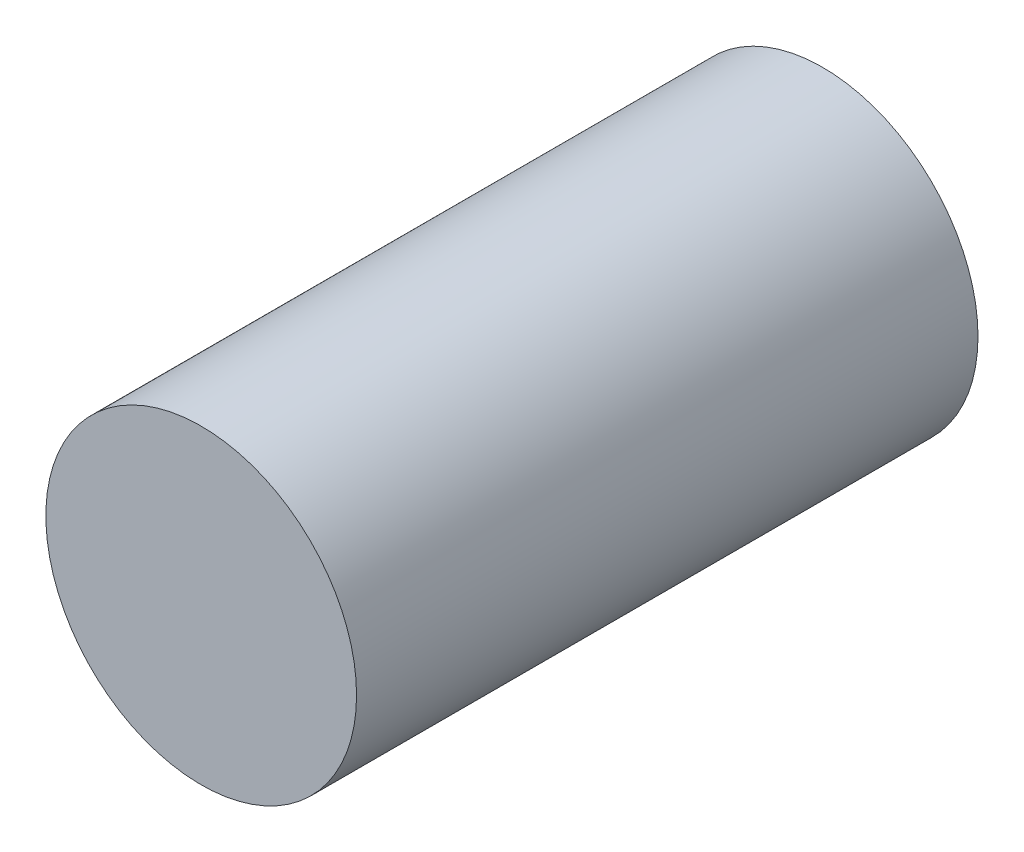
from build123d import *

# Parameters (mm, degrees)
SKETCH2_R           = 2.5
BOSS_EXTRUDE1_DEPTH = 10
CUT_EXTRUDE1_DEPTH  = 9


with BuildPart() as part:
    # Sketch2 → Boss-Extrude1 (new body)
    with BuildSketch(Plane.XY):
        Circle(SKETCH2_R)
    extrude(amount=BOSS_EXTRUDE1_DEPTH)

    # Sketch3 → Cut-Extrude1 (cut)
    with BuildSketch(Plane(origin=(0, 0, 0), x_dir=(-1, 0, 0), z_dir=(0, 0, -1))):
        with BuildLine():
            Line((-1.036635423, 1.254), (1.036635423, 1.254))
            ThreePointArc((1.036635423, 1.254), (0, -1.627), (-1.036635423, 1.254))
        make_face()
    extrude(amount=-CUT_EXTRUDE1_DEPTH, mode=Mode.SUBTRACT)


solid = part.part
